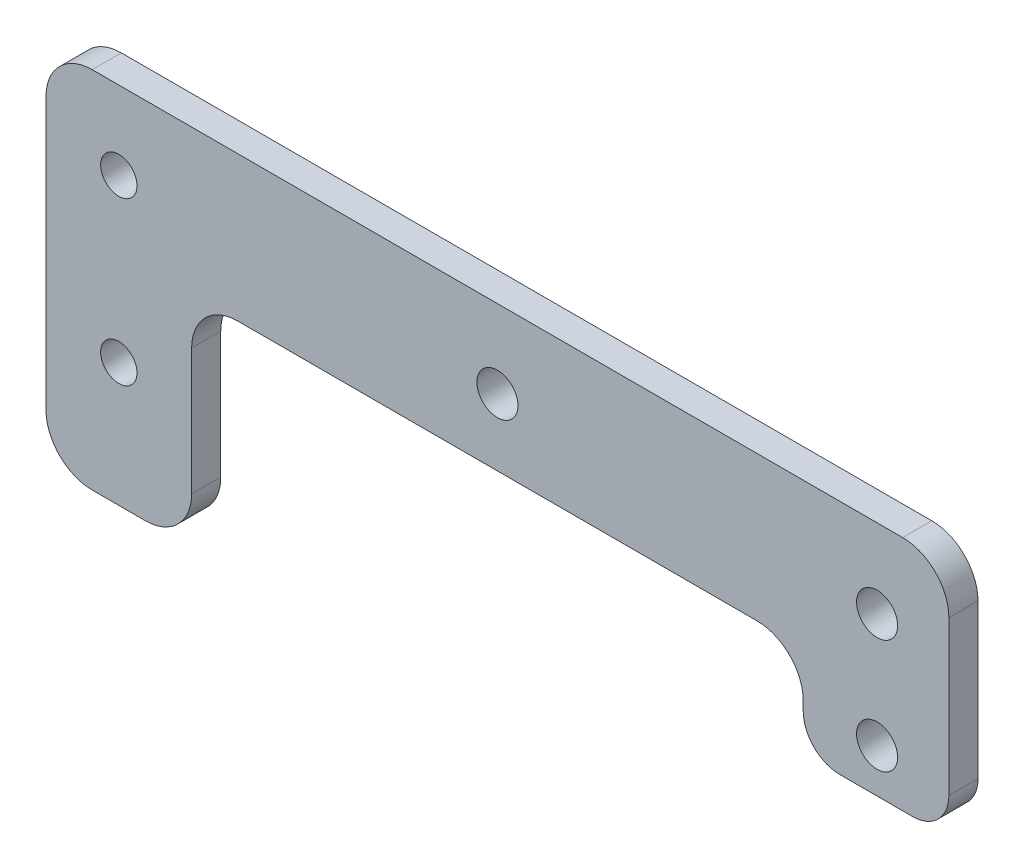
from build123d import *

# Parameters (mm, degrees)
CROQUIS1_R              = 2.821368504
CROQUIS1_R_2            = 2.5
SALIENTE_EXTRUIR1_DEPTH = 4


with BuildPart() as part:
    # Croquis1 → Saliente-Extruir1 (new body)
    # profile 1 of 2: a face of its own
    with BuildSketch(Plane.XY):
        with BuildLine():
            Line((62.043375205, 13.045129829), (62.043375205, 6.699416954))
            Line((62.043375205, 6.699416954), (97.693375205, 6.699416954))
            ThreePointArc((97.693375205, 6.699416954), (102.183503265, 4.839545014), (104.043375205, 0.349416954))
            Line((104.043375205, 0.349416954), (104.043375205, -0.895643676))
            ThreePointArc((104.043375205, -0.895643676), (105.507841299, -4.431177582), (109.043375205, -5.895643676))
            Line((109.043375205, -5.895643676), (119.043375205, -5.895643676))
            ThreePointArc((119.043375205, -5.895643676), (122.578909111, -4.431177582), (124.043375205, -0.895643676))
            Line((124.043375205, -0.895643676), (124.043375205, 6.604356324))
            Line((124.043375205, 6.604356324), (124.043375205, 20.254356324))
            ThreePointArc((124.043375205, 20.254356324), (122.183503265, 24.744484385), (117.693375205, 26.604356324))
            Line((117.693375205, 26.604356324), (62.043375205, 26.604356324))
            Line((62.043375205, 26.604356324), (62.043375205, 18.687866837))
            ThreePointArc((62.043375205, 18.687866837), (64.038384006, 17.861507134), (64.864743709, 15.866498333))
            ThreePointArc((64.864743709, 15.866498333), (64.038384006, 13.871489531), (62.043375205, 13.045129829))
        make_face()
        with Locations((114.183375205, 0.104356324)):
            Circle(CROQUIS1_R, mode=Mode.SUBTRACT)
        with Locations((114.183375205, 15.771437703)):
            Circle(CROQUIS1_R, mode=Mode.SUBTRACT)
    # profile 2 of 2: a face of its own
    with BuildSketch(Plane.XY):
        with BuildLine():
            ThreePointArc((20.043375205, 0.349416954), (21.903247144, 4.839545014), (26.393375205, 6.699416954))
            Line((26.393375205, 6.699416954), (62.043375205, 6.699416954))
            Line((62.043375205, 6.699416954), (62.043375205, 13.045129829))
            ThreePointArc((62.043375205, 13.045129829), (59.222006701, 15.866498333), (62.043375205, 18.687866837))
            Line((62.043375205, 18.687866837), (62.043375205, 26.604356324))
            Line((62.043375205, 26.604356324), (6.393375205, 26.604356324))
            ThreePointArc((6.393375205, 26.604356324), (1.903247144, 24.744484385), (0.043375205, 20.254356324))
            Line((0.043375205, 20.254356324), (0.043375205, 6.604356324))
            Line((0.043375205, 6.604356324), (0.043375205, -17.045643676))
            ThreePointArc((0.043375205, -17.045643676), (1.903247144, -21.535771736), (6.393375205, -23.395643676))
            Line((6.393375205, -23.395643676), (13.693375205, -23.395643676))
            ThreePointArc((13.693375205, -23.395643676), (18.183503265, -21.535771736), (20.043375205, -17.045643676))
            Line((20.043375205, -17.045643676), (20.043375205, 0.349416954))
        make_face()
        with Locations((10.043375205, -6.395643676)):
            Circle(CROQUIS1_R_2, mode=Mode.SUBTRACT)
        with Locations((10.043375205, 15.866498333)):
            Circle(CROQUIS1_R_2, mode=Mode.SUBTRACT)
    extrude(amount=SALIENTE_EXTRUIR1_DEPTH)


solid = part.part
